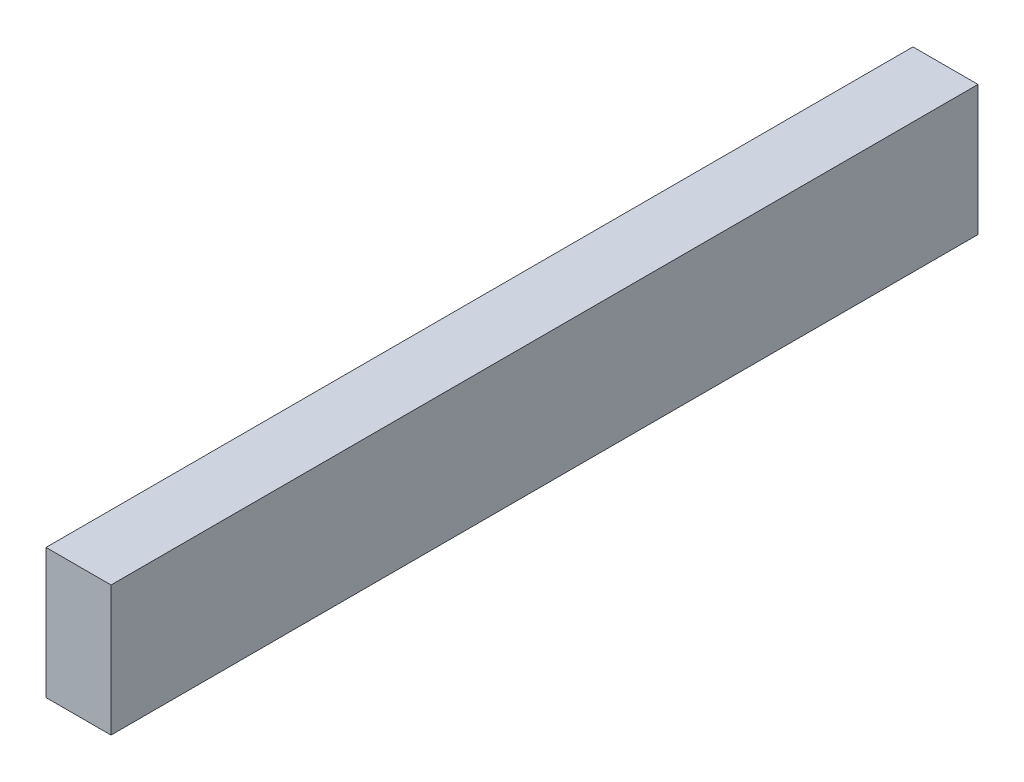
from build123d import *

# Parameters (mm, degrees)
SKETCH_1_W      = 30
SKETCH_1_H      = 30
EXTRUDE_1_DEPTH = 400


with BuildPart() as part:
    # 草圖1 → 填料-伸長1 (new body)
    with BuildSketch(Plane.XY):
        Rectangle(SKETCH_1_W, SKETCH_1_H)
    extrude_1 = extrude(amount=-EXTRUDE_1_DEPTH)

    # 鏡射1: 填料-伸長1 across plane
    add(extrude_1.mirror(Plane(origin=(15, 15, -400), x_dir=(0, 0, 1), z_dir=(0, 1, 0))))


solid = part.part
